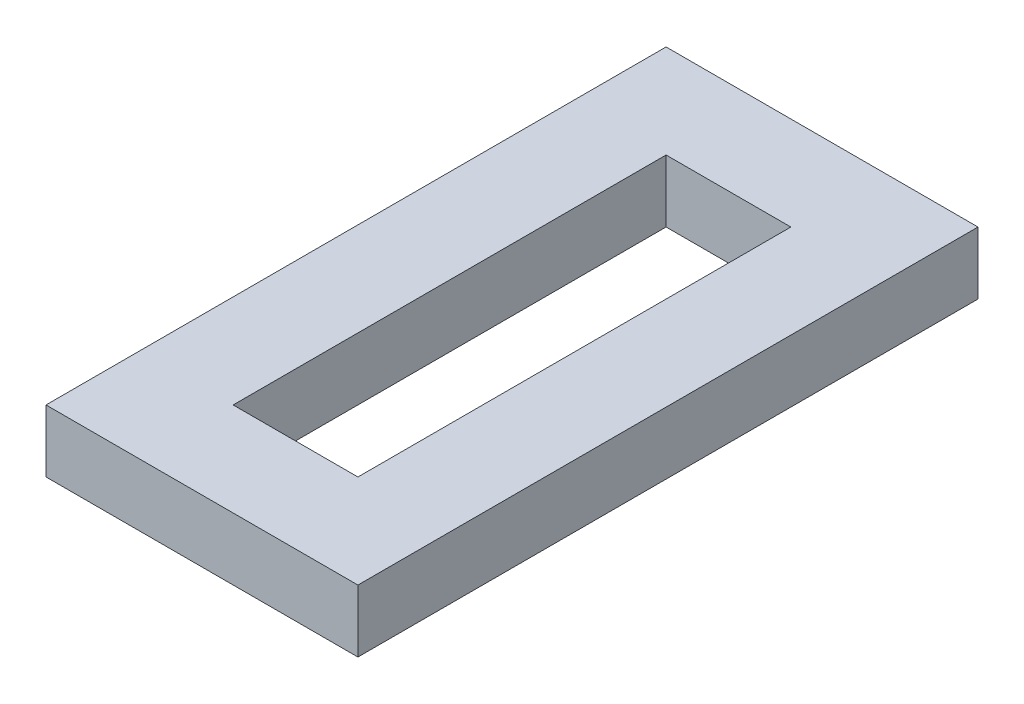
from build123d import *

# Parameters (mm, degrees)
SKETCH1_W           = 50
SKETCH1_H           = 99.4
SKETCH1_W_2         = 20
SKETCH1_H_2         = 69.4
BOSS_EXTRUDE1_DEPTH = 10


with BuildPart() as part:
    # Sketch1 → Boss-Extrude1 (new body)
    with BuildSketch(Plane(origin=(0, 0, 0), x_dir=(1, 0, 0), z_dir=(0, 1, 0))):
        Rectangle(SKETCH1_W, SKETCH1_H)
        Rectangle(SKETCH1_W_2, SKETCH1_H_2, mode=Mode.SUBTRACT)
    extrude(amount=-BOSS_EXTRUDE1_DEPTH)


solid = part.part
